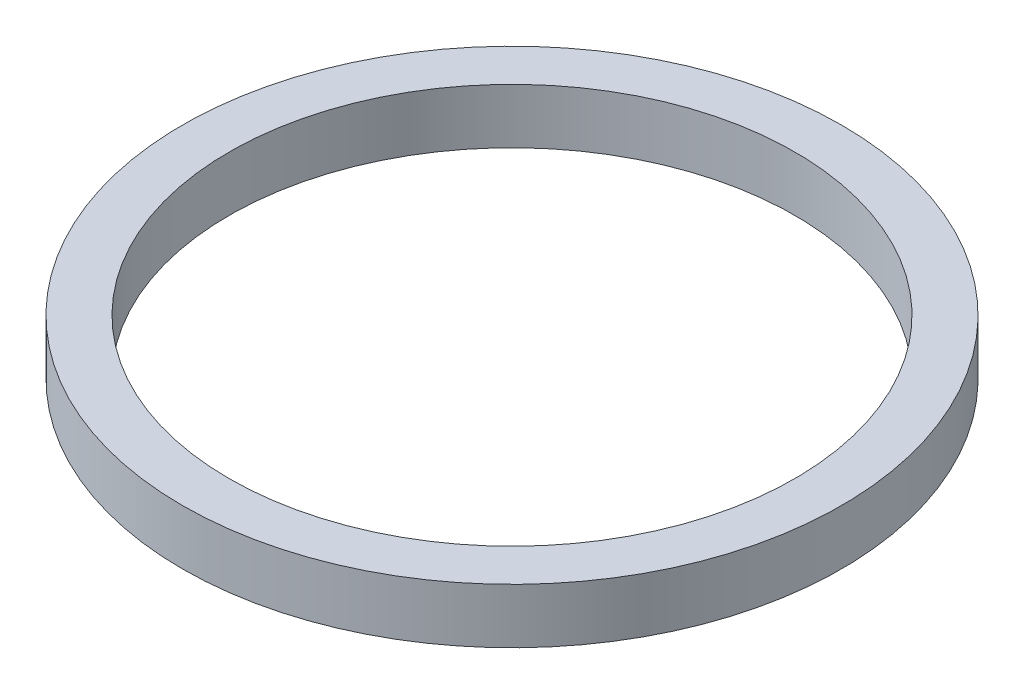
from build123d import *

# Parameters (mm, degrees)
SKETCH2_R           = 15.24
SKETCH2_R_2         = 13.081
BOSS_EXTRUDE1_DEPTH = 2.54


with BuildPart() as part:
    # Sketch2 → Boss-Extrude1 (new body)
    with BuildSketch(Plane(origin=(0, 0, 0), x_dir=(1, 0, 0), z_dir=(0, 1, 0))):
        with Locations(Location((0, 0, 0), (0, 0, 270))):
            Circle(SKETCH2_R)
        with Locations(Location((0, 0, 0), (0, 0, 270))):
            Circle(SKETCH2_R_2, mode=Mode.SUBTRACT)
    extrude(amount=BOSS_EXTRUDE1_DEPTH)


solid = part.part
